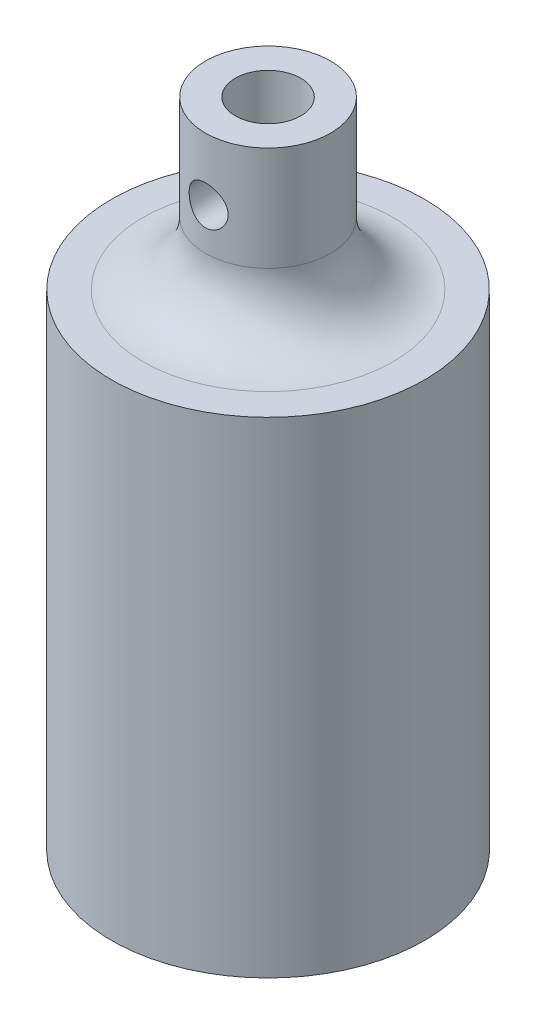
from build123d import *

# Parameters (mm, degrees)
SKETCH1_R                 = 9.5377
BOSS_EXTRUDE1_DEPTH       = 29.591
SKETCH2_R                 = 3.81
BOSS_EXTRUDE2_DEPTH       = 10.16
SKETCH3_R                 = 1.9939
CUT_EXTRUDE1_DEPTH        = 12.7
SKETCH4_R                 = 8.4836
CUT_EXTRUDE2_DEPTH        = 27.94
FILLET1_R                 = 3.81
F_4_48_TAPPED_HOLE2_D     = 2.3749
F_4_48_TAPPED_HOLE2_DEPTH = 8.89
F_4_48_TAPPED_HOLE2_TIP   = 0.713491942


with BuildPart() as part:
    # Sketch1 → Boss-Extrude1 (new body)
    with BuildSketch(Plane(origin=(0, 0, 0), x_dir=(1, 0, 0), z_dir=(0, 1, 0))):
        with Locations(Location((0, 0, 0), (0, 0, 90))):
            Circle(SKETCH1_R)
    extrude(amount=BOSS_EXTRUDE1_DEPTH)

    # Sketch2 → Boss-Extrude2 (add)
    with BuildSketch(Plane(origin=(0, 29.591, 0), x_dir=(1, 0, 0), z_dir=(0, 1, 0))):
        with Locations(Location((0, 0, 0), (0, 0, 270))):
            Circle(SKETCH2_R)
    extrude(amount=BOSS_EXTRUDE2_DEPTH)

    # Sketch3 → Cut-Extrude1 (cut)
    with BuildSketch(Plane(origin=(0, 39.751, 0), x_dir=(1, 0, 0), z_dir=(0, 1, 0))):
        with Locations(Location((0, 0, 0), (0, 0, 270))):
            Circle(SKETCH3_R)
    extrude(amount=-CUT_EXTRUDE1_DEPTH, mode=Mode.SUBTRACT)

    # Sketch4 → Cut-Extrude2 (cut)
    with BuildSketch(Plane.XZ):
        with Locations(Location((0, 0, 0), (0, 0, 270))):
            Circle(SKETCH4_R)
    extrude(amount=-CUT_EXTRUDE2_DEPTH, mode=Mode.SUBTRACT)

    # Fillet1
    fillet1_edges = [part.edges().sort_by_distance(p)[0] for p in [
        (0, 29.591, -3.81),
    ]]
    fillet(fillet1_edges, radius=FILLET1_R)

    # #4-48 Tapped Hole2
    with Locations(Plane.XY.offset(9.5377)):
        with Locations((0, 35.941)):
            Hole(F_4_48_TAPPED_HOLE2_D / 2, depth=F_4_48_TAPPED_HOLE2_DEPTH)
            with Locations((0, 0, -(F_4_48_TAPPED_HOLE2_DEPTH + F_4_48_TAPPED_HOLE2_TIP / 2))):  # 118° drill point
                Cone(0, F_4_48_TAPPED_HOLE2_D / 2, F_4_48_TAPPED_HOLE2_TIP, mode=Mode.SUBTRACT)


solid = part.part
